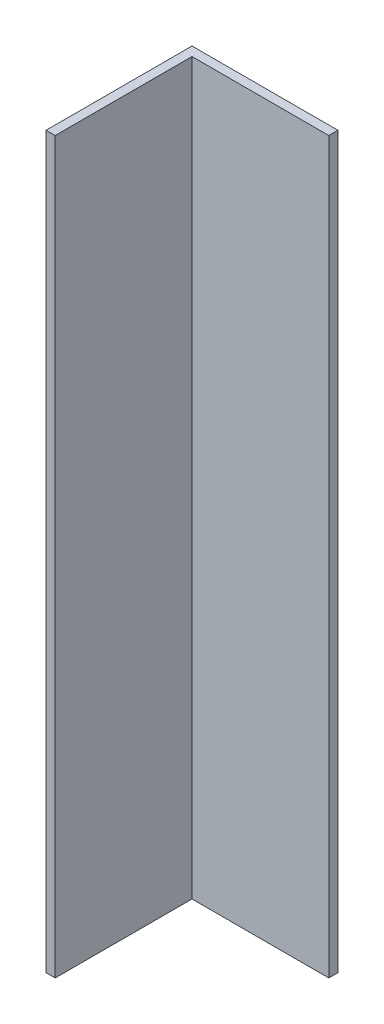
from build123d import *

# Parameters (mm, degrees)
SKETCH1_W           = 25.4
SKETCH1_H           = 25.4
BOSS_EXTRUDE1_DEPTH = 127
SKETCH2_W           = 23.8125
SKETCH2_H           = 23.8125
CUT_EXTRUDE1_DEPTH  = 127


with BuildPart() as part:
    # Sketch1 → Boss-Extrude1 (new body)
    with BuildSketch(Plane(origin=(0, 0, 0), x_dir=(1, 0, 0), z_dir=(0, 1, 0))):
        with Locations((12.7, -12.7)):
            Rectangle(SKETCH1_W, SKETCH1_H)
    extrude(amount=BOSS_EXTRUDE1_DEPTH)

    # Sketch2 → Cut-Extrude1 (cut)
    with BuildSketch(Plane(origin=(0, 127, 0), x_dir=(1, 0, 0), z_dir=(0, 1, 0))):
        with Locations((13.49375, -13.49375)):
            Rectangle(SKETCH2_W, SKETCH2_H)
    extrude(amount=-CUT_EXTRUDE1_DEPTH, mode=Mode.SUBTRACT)


solid = part.part
